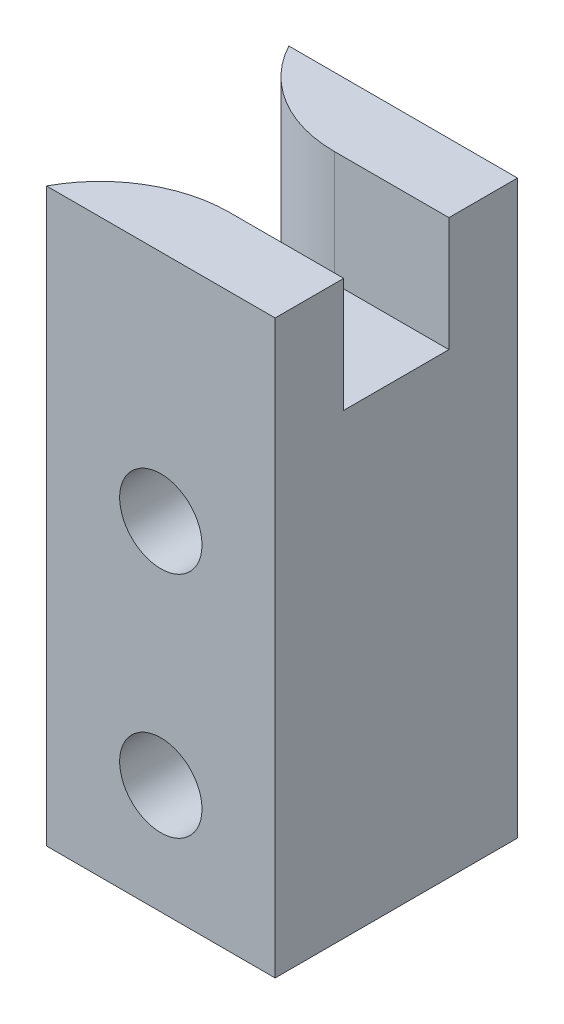
from build123d import *

# Parameters (mm, degrees)
SKETCH1_W                       = 10
SKETCH1_H                       = 10.6
BOSS_EXTRUDE1_DEPTH             = 20
CUT_EXTRUDE1_DEPTH              = 25.745908753
BOSS_EXTRUDE2_DEPTH             = 5
BOSS_EXTRUDE2_DIRECTION_2_REACH = 26.746
SKETCH5_R                       = 1.8
CUT_EXTRUDE2_DEPTH              = 29.937173447


with BuildPart() as part:
    # Sketch1 → Boss-Extrude1 (new body)
    with BuildSketch(Plane(origin=(0, 0, 0), x_dir=(1, 0, 0), z_dir=(0, 1, 0))):
        with Locations((5, 5.3)):
            Rectangle(SKETCH1_W, SKETCH1_H)
    extrude(amount=BOSS_EXTRUDE1_DEPTH)

    # Sketch3 → Cut-Extrude1 (cut, through all)
    with BuildSketch(Plane.XY):
        with BuildLine():
            Line((0, 17.31662479), (0, 20))
            Line((0, 20), (5, 20))
            ThreePointArc((5, 20), (2.162725669, 19.286764074), (0, 17.31662479))
        make_face()
    extrude(amount=-CUT_EXTRUDE1_DEPTH, mode=Mode.SUBTRACT)

    # Sketch4 → Boss-Extrude2 (add)
    with BuildSketch(Plane(origin=(0, 20, 0), x_dir=(1, 0, 0), z_dir=(0, 1, 0))):
        with BuildLine():
            Line((10, 10.6), (0, 10.6))
            ThreePointArc((0, 10.6), (2.084524053, 8.407540088), (5, 7.6))
            Line((5, 7.6), (10, 7.6))
            Line((10, 7.6), (10, 10.6))
        make_face()
        with BuildLine():
            Line((0, 0), (10, 0))
            Line((10, 0), (10, 3))
            Line((10, 3), (5, 3))
            ThreePointArc((5, 3), (2.084524053, 2.192459912), (0, 0))
        make_face()
    extrude(amount=BOSS_EXTRUDE2_DEPTH)

    # Sketch4 → Boss-Extrude2 direction 2 (add, up to next)
    with BuildSketch(Plane(origin=(0, 20, 0), x_dir=(1, 0, 0), z_dir=(0, 1, 0)), mode=Mode.PRIVATE) as boss_extrude2_direction_2_sk1:
        with BuildLine():
            Line((10, 10.6), (0, 10.6))
            ThreePointArc((0, 10.6), (2.084524053, 8.407540088), (5, 7.6))
            Line((5, 7.6), (10, 7.6))
            Line((10, 7.6), (10, 10.6))
        make_face()
    boss_extrude2_direction_2_tool1 = extrude(boss_extrude2_direction_2_sk1.sketch, amount=-BOSS_EXTRUDE2_DIRECTION_2_REACH, mode=Mode.PRIVATE) - part.part
    # Sketch4 → Boss-Extrude2 direction 2 (add, up to next)
    with BuildSketch(Plane(origin=(0, 20, 0), x_dir=(1, 0, 0), z_dir=(0, 1, 0)), mode=Mode.PRIVATE) as boss_extrude2_direction_2_sk2:
        with BuildLine():
            Line((0, 0), (10, 0))
            Line((10, 0), (10, 3))
            Line((10, 3), (5, 3))
            ThreePointArc((5, 3), (2.084524053, 2.192459912), (0, 0))
        make_face()
    boss_extrude2_direction_2_tool2 = extrude(boss_extrude2_direction_2_sk2.sketch, amount=-BOSS_EXTRUDE2_DIRECTION_2_REACH, mode=Mode.PRIVATE) - part.part
    add(boss_extrude2_direction_2_tool1.solids().sort_by_distance((5.642353, 20, -9.211407))[0])
    add(boss_extrude2_direction_2_tool2.solids().sort_by_distance((5.642353, 20, -1.388593))[0])

    # Sketch5 → Cut-Extrude2 (cut, through all)
    with BuildSketch(Plane.XY):
        with Locations((5, 14.8)):
            Circle(SKETCH5_R)
        with Locations((5, 4.8)):
            Circle(SKETCH5_R)
    extrude(amount=-CUT_EXTRUDE2_DEPTH, mode=Mode.SUBTRACT)


solid = part.part
